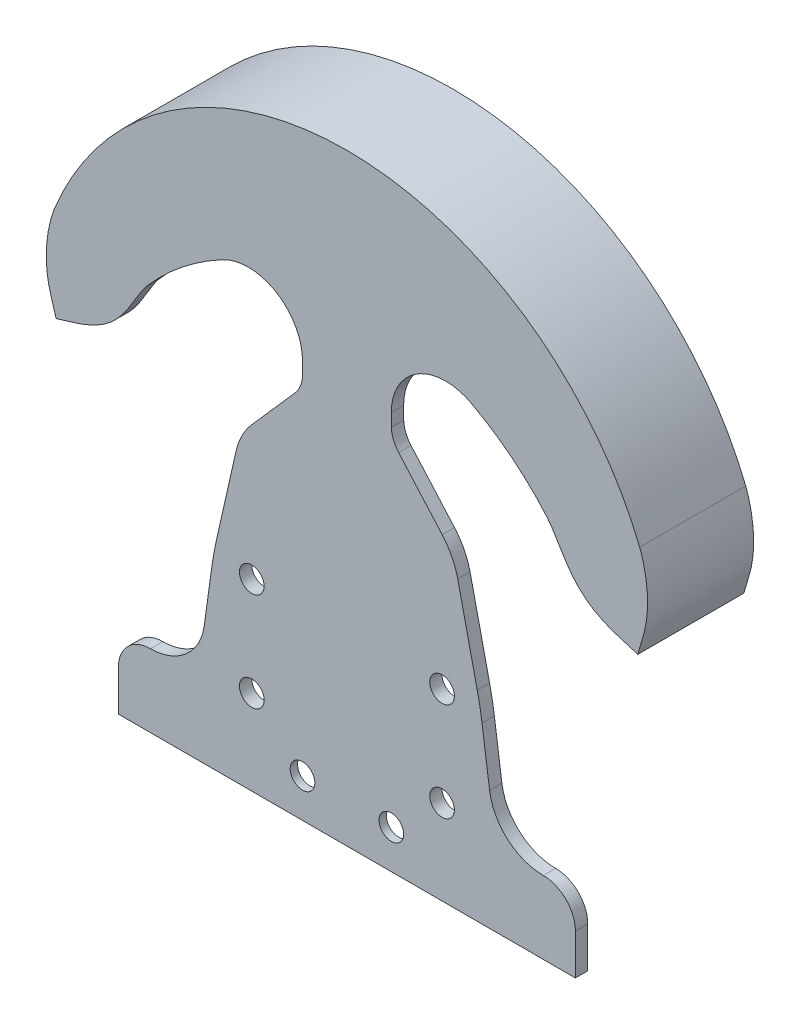
from build123d import *

# Parameters (mm, degrees)
EXTRUDE_6_DEPTH     = 5
EXTRUDE_START       = 35
EXTRUDE_7_DEPTH     = 35
EXTRUDE_START_2     = 3
EXTRUDE_9_DEPTH     = 3
EXTRUDE_START_3     = -5
EXTRUDE_10_DEPTH    = 5
SKETCH_10_W         = 60
SKETCH_10_H         = 60
CUT_EXTRUDE_1_DEPTH = 2
SKETCH_11_R         = 5
CUT_EXTRUDE_2_DEPTH = 452.099681051
SKETCH_12_R         = 5
EXTRUDE_11_DEPTH    = 8.5
SKETCH_13_R         = 5
CUT_EXTRUDE_3_DEPTH = 452.27255871


with BuildPart() as part:
    # 草图1 → 凸台-拉伸6 (new body)
    with BuildSketch(Plane.XY):
        with BuildLine():
            Line((-261.450720316, 145.890589925), (-225.450720316, 145.890589925))
            Line((-225.450720316, 145.890589925), (-225.450720316, 178.890589925))
            ThreePointArc((-225.450720316, 178.890589925), (-214.769626935, 197.755434291), (-193.097779139, 198.302354631))
            ThreePointArc((-193.097779139, 198.302354631), (-176.57396716, 187.416034475), (-162.337296497, 173.673198621))
            add(Edge.make_bspline(
                [(-162.337296497, 173.673198621), (-162.156875291, 173.463481873), (-161.822225891, 173.054756566), (-161.063474452, 172.050768196), (-160.063987759, 170.585134366), (-158.787124206, 168.543836152), (-156.997641473, 165.568209672), (-154.571279927, 161.549889138), (-151.626375874, 157.538077997), (-148.672649817, 154.494736574), (-146.127007775, 152.364528927), (-143.251428184, 150.44315688), (-140.050440584, 148.751400908), (-137.115285344, 147.525731802), (-134.879758049, 146.743974589), (-133.82475202, 146.40525156), (-133.304192156, 146.244484384), (-133.018197555, 146.156935282), (-132.49622001, 145.996719787), (-131.761747497, 145.771494768), (-130.580333604, 145.409094728), (-128.515792668, 144.775850911), (-126.745180421, 144.232742639), (-125.564995753, 143.870743314)],
                knots=[0, 0, 0, 0, 0.036189277, 0.072378554, 0.144757108, 0.217135663, 0.289514217, 0.434271325, 0.579028433, 0.651406988, 0.723785542, 0.796164096, 0.86854265, 0.940921204, 0.977110481, 0.99520512, 0.99972878, 1.004252439, 1.013299759, 1.031394397, 1.049489036, 1.085678313, 1.158056867, 1.158056867, 1.158056867, 1.158056867], degree=3))
            add(Edge.make_bspline(
                [(-125.564995753, 143.870743314), (-125.319328425, 144.703783329), (-124.950831601, 145.953319109), (-124.459485834, 147.619463786), (-124.091018178, 148.868829865), (-123.783829848, 149.910735954), (-123.538375028, 150.742539585), (-123.384292129, 151.26633611), (-123.262568578, 151.676397427), (-123.103211031, 152.229505213), (-122.860854039, 153.128803703), (-122.424172839, 154.96575744), (-121.975216766, 157.5298623), (-121.665266817, 160.53504042), (-121.554138645, 163.432908823), (-121.626990365, 167.132016891), (-122.057224922, 171.398449835), (-122.756266397, 175.071531477), (-123.379742187, 177.589111625), (-123.858705151, 179.255312853), (-124.251233744, 180.450589585), (-124.560787997, 181.304793735), (-124.711671396, 181.693138272), (-124.791544522, 181.890589925)],
                knots=[0, 0, 0, 0, 0.077542679, 0.116314019, 0.155085358, 0.193856698, 0.213242368, 0.232628037, 0.242320872, 0.252013707, 0.271399377, 0.310170717, 0.387713396, 0.465256075, 0.542798754, 0.620341433, 0.775426792, 0.93051215, 1.008054829, 1.085597508, 1.163140187, 1.201911527, 1.240682866, 1.240682866, 1.240682866, 1.240682866], degree=3))
            ThreePointArc((-124.791544522, 181.890589925), (-243.450720316, 261.890589925), (-362.109896109, 181.890589925))
            add(Edge.make_bspline(
                [(-362.109896109, 181.890589925), (-362.189769235, 181.693138272), (-362.340652634, 181.304793735), (-362.650206888, 180.450589585), (-363.04273548, 179.255312853), (-363.521698445, 177.589111625), (-364.145174234, 175.071531477), (-364.844215709, 171.398449835), (-365.274450267, 167.132016891), (-365.347301986, 163.432908823), (-365.236173814, 160.53504042), (-364.926223866, 157.5298623), (-364.477267792, 154.96575744), (-364.040586592, 153.128803703), (-363.798229601, 152.229505213), (-363.638872054, 151.676397427), (-363.517148503, 151.26633611), (-363.363065603, 150.742539585), (-363.117610784, 149.910735954), (-362.810422454, 148.868829865), (-362.441954797, 147.619463786), (-361.950609031, 145.953319109), (-361.582112206, 144.703783329), (-361.336444879, 143.870743314)],
                knots=[0, 0, 0, 0, 0.03877134, 0.077542679, 0.155085358, 0.232628037, 0.310170717, 0.465256075, 0.620341433, 0.697884112, 0.775426792, 0.852969471, 0.93051215, 0.969283489, 0.988669159, 0.998361994, 1.008054829, 1.027440499, 1.046826169, 1.085597508, 1.124368848, 1.163140187, 1.240682866, 1.240682866, 1.240682866, 1.240682866], degree=3))
            add(Edge.make_bspline(
                [(-361.336444879, 143.870743314), (-360.15626021, 144.232742639), (-358.385647964, 144.775850911), (-356.321107028, 145.409094728), (-355.139693134, 145.771494768), (-354.405220621, 145.996719787), (-353.883243076, 146.156935282), (-353.597248475, 146.244484384), (-353.076688611, 146.40525156), (-352.021682583, 146.743974589), (-349.786155288, 147.525731802), (-346.851000047, 148.751400908), (-343.650012448, 150.44315688), (-340.774432857, 152.364528927), (-338.228790814, 154.494736574), (-335.275064757, 157.538077997), (-332.330160705, 161.549889138), (-329.903799158, 165.568209672), (-328.114316425, 168.543836152), (-326.837452873, 170.585134366), (-325.83796618, 172.050768196), (-325.079214741, 173.054756566), (-324.74456534, 173.463481873), (-324.564144135, 173.673198621)],
                knots=[0, 0, 0, 0, 0.072378554, 0.108567831, 0.12666247, 0.144757108, 0.153804428, 0.158328087, 0.162851747, 0.180946385, 0.217135663, 0.289514217, 0.361892771, 0.434271325, 0.506649879, 0.579028433, 0.723785542, 0.86854265, 0.940921204, 1.013299759, 1.085678313, 1.12186759, 1.158056867, 1.158056867, 1.158056867, 1.158056867], degree=3))
            ThreePointArc((-324.564144135, 173.673198621), (-310.327473472, 187.416034475), (-293.803661492, 198.302354631))
            ThreePointArc((-293.803661492, 198.302354631), (-272.131813696, 197.755434291), (-261.450720316, 178.890589925))
            Line((-261.450720316, 178.890589925), (-261.450720316, 145.890589925))
        make_face()
    extrude(amount=EXTRUDE_6_DEPTH)

    # 草图4 → 凸台-拉伸7 (add)
    with BuildSketch(Plane(origin=(0, 0, 0), x_dir=(-1, 0, 0), z_dir=(0, 0, -1)).offset(EXTRUDE_START)):
        with BuildLine():
            Line((127.170262667, 149.033300918), (125.564995753, 143.870743314))
            add(Edge.make_bspline(
                [(124.791544522, 181.890589925), (124.711671396, 181.693138272), (124.560787997, 181.304793735), (124.251233744, 180.450589585), (123.858705151, 179.255312853), (123.379742187, 177.589111625), (122.756266397, 175.071531477), (122.057224922, 171.398449835), (121.626990365, 167.132016891), (121.554138645, 163.432908823), (121.665266817, 160.53504042), (121.975216766, 157.5298623), (122.424172839, 154.96575744), (122.860854039, 153.128803703), (123.103211031, 152.229505213), (123.262568578, 151.676397427), (123.384292129, 151.26633611), (123.538375028, 150.742539585), (123.783829848, 149.910735954), (124.091018178, 148.868829865), (124.459485834, 147.619463786), (124.950831601, 145.953319109), (125.319328425, 144.703783329), (125.564995753, 143.870743314)],
                knots=[0, 0, 0, 0, 0.03877134, 0.077542679, 0.155085358, 0.232628037, 0.310170717, 0.465256075, 0.620341433, 0.697884112, 0.775426792, 0.852969471, 0.93051215, 0.969283489, 0.988669159, 0.998361994, 1.008054829, 1.027440499, 1.046826169, 1.085597508, 1.124368848, 1.163140187, 1.240682866, 1.240682866, 1.240682866, 1.240682866], degree=3))
            ThreePointArc((124.791544522, 181.890589925), (243.450720316, 261.890589925), (362.109896109, 181.890589925))
            add(Edge.make_bspline(
                [(361.336444879, 143.870743314), (361.582112206, 144.703783329), (361.950609031, 145.953319109), (362.441954797, 147.619463786), (362.810422454, 148.868829865), (363.117610784, 149.910735954), (363.363065603, 150.742539585), (363.517148503, 151.26633611), (363.638872054, 151.676397427), (363.798229601, 152.229505213), (364.040586592, 153.128803703), (364.477267792, 154.96575744), (364.926223866, 157.5298623), (365.236173814, 160.53504042), (365.347301986, 163.432908823), (365.274450267, 167.132016891), (364.844215709, 171.398449835), (364.145174234, 175.071531477), (363.521698445, 177.589111625), (363.04273548, 179.255312853), (362.650206888, 180.450589585), (362.340652634, 181.304793735), (362.189769235, 181.693138272), (362.109896109, 181.890589925)],
                knots=[0, 0, 0, 0, 0.077542679, 0.116314019, 0.155085358, 0.193856698, 0.213242368, 0.232628037, 0.242320872, 0.252013707, 0.271399377, 0.310170717, 0.387713396, 0.465256075, 0.542798754, 0.620341433, 0.775426792, 0.93051215, 1.008054829, 1.085597508, 1.163140187, 1.201911527, 1.240682866, 1.240682866, 1.240682866, 1.240682866], degree=3))
            Line((361.336444879, 143.870743314), (359.731177964, 149.033300918))
            add(Edge.make_bspline(
                [(359.731177964, 149.033300918), (359.950339418, 149.776445736), (360.223965906, 150.702963861), (360.553310783, 151.82201926), (360.6884952, 152.278173605), (360.803836512, 152.671346005), (360.934892706, 153.132544258), (361.128886852, 153.858988834), (361.390896424, 154.952949665), (361.735647572, 156.660236204), (362.051196026, 158.772806677), (362.26806635, 161.256681255), (362.366276255, 164.469199799), (362.184670789, 168.271445245), (361.630356426, 172.374129003), (361.006813334, 175.319090727), (360.476773932, 177.3386287), (360.078361926, 178.675251932), (359.757641116, 179.631064702), (359.508695791, 180.3104049), (359.391206809, 180.611369751), (359.328821677, 180.765589925)],
                knots=[0.133854699, 0.133854699, 0.133854699, 0.133854699, 0.203031459, 0.220325649, 0.237619839, 0.246266934, 0.254914029, 0.27220822, 0.3067966, 0.34138498, 0.410561741, 0.479738501, 0.548915262, 0.687268783, 0.825622303, 0.963975824, 1.033152585, 1.102329345, 1.171506106, 1.206094486, 1.240682866, 1.240682866, 1.240682866, 1.240682866], degree=3))
            ThreePointArc((359.328821677, 180.765589925), (243.450720316, 258.890589925), (127.572618955, 180.765589925))
            add(Edge.make_bspline(
                [(127.572618955, 180.765589925), (127.510233823, 180.611369751), (127.392744841, 180.3104049), (127.143799516, 179.631064702), (126.823078706, 178.675251932), (126.4246667, 177.3386287), (125.894627297, 175.319090727), (125.271084206, 172.374129003), (124.716769843, 168.271445245), (124.535164377, 164.469199799), (124.633374281, 161.256681255), (124.850244605, 158.772806677), (125.16579306, 156.660236204), (125.510544207, 154.952949665), (125.77255378, 153.858988834), (125.966547926, 153.132544258), (126.09760412, 152.671346005), (126.212945431, 152.278173605), (126.348129848, 151.82201926), (126.677474725, 150.702963861), (126.951101213, 149.776445736), (127.170262667, 149.033300918)],
                knots=[0, 0, 0, 0, 0.03458838, 0.06917676, 0.138353521, 0.207530281, 0.276707042, 0.415060563, 0.553414084, 0.691767605, 0.760944365, 0.830121126, 0.899297886, 0.933886267, 0.968474647, 0.985768837, 0.994415932, 1.003063027, 1.020357217, 1.037651407, 1.106828168, 1.106828168, 1.106828168, 1.106828168], degree=3))
        make_face()
    extrude(amount=-EXTRUDE_7_DEPTH)

    # 草图5 → 凸台-拉伸9 (add)
    with BuildSketch(Plane(origin=(0, 0, -35), x_dir=(-1, 0, 0), z_dir=(0, 0, -1)).offset(EXTRUDE_START_2)):
        with BuildLine():
            ThreePointArc((331.982158518, 175.916591621), (243.450718914, 231.890591806), (154.919280911, 175.916589087))
            add(Edge.make_bspline(
                [(125.564995753, 143.870743314), (140.048024823, 150.380241778), (148.204578659, 161.771483118), (154.919280911, 175.916589087)],
                knots=[0, 0, 0, 0, 1, 1, 1, 1], degree=3))
            add(Edge.make_bspline(
                [(124.791544421, 181.890589675), (124.711671396, 181.693138272), (124.560787997, 181.304793735), (124.251233744, 180.450589585), (123.858705151, 179.255312853), (123.379742187, 177.589111625), (122.756266397, 175.071531477), (122.057224922, 171.398449835), (121.626990365, 167.132016891), (121.554138645, 163.432908823), (121.665266817, 160.53504042), (121.975216766, 157.5298623), (122.424172839, 154.96575744), (122.860854039, 153.128803703), (123.103211031, 152.229505213), (123.262568578, 151.676397427), (123.384292129, 151.26633611), (123.538375028, 150.742539585), (123.783829848, 149.910735954), (124.091018178, 148.868829865), (124.459485834, 147.619463786), (124.950831601, 145.953319109), (125.319328425, 144.703783329), (125.564995753, 143.870743314)],
                knots=[3.3e-08, 3.3e-08, 3.3e-08, 3.3e-08, 0.03877134, 0.077542679, 0.155085358, 0.232628037, 0.310170717, 0.465256075, 0.620341433, 0.697884112, 0.775426792, 0.852969471, 0.93051215, 0.969283489, 0.988669159, 0.998361994, 1.008054829, 1.027440499, 1.046826169, 1.085597508, 1.124368848, 1.163140187, 1.240682866, 1.240682866, 1.240682866, 1.240682866], degree=3))
            ThreePointArc((124.791544421, 181.890589675), (243.45071839, 261.890589925), (362.109894766, 181.890593245))
            add(Edge.make_bspline(
                [(361.336444879, 143.870743314), (361.582112197, 144.70378341), (361.950609007, 145.953319312), (362.441954754, 147.619464151), (362.810422396, 148.868830353), (363.117610714, 149.910736543), (363.363065524, 150.742540255), (363.517148417, 151.266336831), (363.638871963, 151.676398188), (363.798229504, 152.229506028), (364.040586483, 153.128804605), (364.477267653, 154.965758517), (364.92622367, 157.529863615), (365.236173534, 160.535042007), (365.347301608, 163.432910665), (365.274449745, 167.132019051), (364.844214992, 171.398452349), (364.14517332, 175.071534282), (363.521697383, 177.589114625), (363.042734316, 179.25531598), (362.650205645, 180.4505928), (362.340651333, 181.304797013), (362.189767907, 181.693141579), (362.109894766, 181.890593245)],
                knots=[-0.012406829, -0.012406829, -0.012406829, -0.012406829, 0.06513585, 0.10390719, 0.14267853, 0.181449869, 0.200835539, 0.220221209, 0.229914044, 0.239606879, 0.258992548, 0.297763888, 0.375306567, 0.452849246, 0.530391925, 0.607934605, 0.763019963, 0.918105321, 0.995648, 1.073190679, 1.150733359, 1.189504698, 1.228276255, 1.228276255, 1.228276255, 1.228276255], degree=3))
            add(Edge.make_bspline(
                [(361.336444879, 143.870743314), (346.853415021, 150.380241382), (338.696860769, 161.771485652), (331.982158518, 175.916591621)],
                knots=[0, 0, 0, 0, 1, 1, 1, 1], degree=3))
        make_face()
    extrude(amount=-EXTRUDE_9_DEPTH)

    # 草图7 → 凸台-拉伸10 (add)
    with BuildSketch(Plane.XY.offset(5).offset(EXTRUDE_START_3)):
        with BuildLine():
            Line((-225.450720316, 173.626640826), (-225.450720316, 178.890589925))
            ThreePointArc((-225.450720316, 178.890589925), (-214.769626935, 197.755434291), (-193.097779139, 198.302354631))
            ThreePointArc((-193.097779139, 198.302354631), (-176.57396716, 187.416034475), (-162.337296497, 173.673198621))
            add(Edge.make_bspline(
                [(-162.337296497, 173.673198621), (-162.156875291, 173.463481873), (-161.822225891, 173.054756566), (-161.063474452, 172.050768196), (-160.063987759, 170.585134366), (-158.787124206, 168.543836152), (-156.997641473, 165.568209672), (-154.571279927, 161.549889138), (-151.626375874, 157.538077997), (-148.672649817, 154.494736574), (-146.127007775, 152.364528927), (-143.251428184, 150.44315688), (-140.050440584, 148.751400908), (-137.115285344, 147.525731802), (-134.879758049, 146.743974589), (-133.82475202, 146.40525156), (-133.304192156, 146.244484384), (-133.018197555, 146.156935282), (-132.49622001, 145.996719787), (-131.761747497, 145.771494768), (-130.580333604, 145.409094728), (-128.515792668, 144.775850911), (-126.745180421, 144.232742639), (-125.564995753, 143.870743314)],
                knots=[0, 0, 0, 0, 0.036189277, 0.072378554, 0.144757108, 0.217135663, 0.289514217, 0.434271325, 0.579028433, 0.651406988, 0.723785542, 0.796164096, 0.86854265, 0.940921204, 0.977110481, 0.99520512, 0.99972878, 1.004252439, 1.013299759, 1.031394397, 1.049489036, 1.085678313, 1.158056867, 1.158056867, 1.158056867, 1.158056867], degree=3))
            add(Edge.make_bspline(
                [(-125.564995753, 143.870743314), (-125.319328425, 144.703783329), (-124.950831601, 145.953319109), (-124.459485834, 147.619463786), (-124.091018178, 148.868829865), (-123.783829848, 149.910735954), (-123.538375028, 150.742539585), (-123.384292129, 151.26633611), (-123.262568578, 151.676397427), (-123.103211031, 152.229505213), (-122.860854039, 153.128803703), (-122.424172839, 154.96575744), (-121.975216766, 157.5298623), (-121.665266817, 160.53504042), (-121.554138645, 163.432908823), (-121.626990365, 167.132016891), (-122.057224922, 171.398449835), (-122.756266397, 175.071531477), (-123.379742187, 177.589111625), (-123.858705151, 179.255312853), (-124.251233744, 180.450589585), (-124.560787997, 181.304793735), (-124.711671396, 181.693138272), (-124.791544522, 181.890589925)],
                knots=[0, 0, 0, 0, 0.077542679, 0.116314019, 0.155085358, 0.193856698, 0.213242368, 0.232628037, 0.242320872, 0.252013707, 0.271399377, 0.310170717, 0.387713396, 0.465256075, 0.542798754, 0.620341433, 0.775426792, 0.93051215, 1.008054829, 1.085597508, 1.163140187, 1.201911527, 1.240682866, 1.240682866, 1.240682866, 1.240682866], degree=3))
            ThreePointArc((-124.791544522, 181.890589925), (-243.450720316, 261.890589925), (-362.109896109, 181.890589925))
            add(Edge.make_bspline(
                [(-362.109896109, 181.890589925), (-362.189769235, 181.693138272), (-362.340652634, 181.304793735), (-362.650206888, 180.450589585), (-363.04273548, 179.255312853), (-363.521698445, 177.589111625), (-364.145174234, 175.071531477), (-364.844215709, 171.398449835), (-365.274450267, 167.132016891), (-365.347301986, 163.432908823), (-365.236173814, 160.53504042), (-364.926223866, 157.5298623), (-364.477267792, 154.96575744), (-364.040586592, 153.128803703), (-363.798229601, 152.229505213), (-363.638872054, 151.676397427), (-363.517148503, 151.26633611), (-363.363065603, 150.742539585), (-363.117610784, 149.910735954), (-362.810422454, 148.868829865), (-362.441954797, 147.619463786), (-361.950609031, 145.953319109), (-361.582112206, 144.703783329), (-361.336444879, 143.870743314)],
                knots=[0, 0, 0, 0, 0.03877134, 0.077542679, 0.155085358, 0.232628037, 0.310170717, 0.465256075, 0.620341433, 0.697884112, 0.775426792, 0.852969471, 0.93051215, 0.969283489, 0.988669159, 0.998361994, 1.008054829, 1.027440499, 1.046826169, 1.085597508, 1.124368848, 1.163140187, 1.240682866, 1.240682866, 1.240682866, 1.240682866], degree=3))
            add(Edge.make_bspline(
                [(-361.336444879, 143.870743314), (-360.15626021, 144.232742639), (-358.385647964, 144.775850911), (-356.321107028, 145.409094728), (-355.139693134, 145.771494768), (-354.405220621, 145.996719787), (-353.883243076, 146.156935282), (-353.597248475, 146.244484384), (-353.076688611, 146.40525156), (-352.021682583, 146.743974589), (-349.786155288, 147.525731802), (-346.851000047, 148.751400908), (-343.650012448, 150.44315688), (-340.774432857, 152.364528927), (-338.228790814, 154.494736574), (-335.275064757, 157.538077997), (-332.330160705, 161.549889138), (-329.903799158, 165.568209672), (-328.114316425, 168.543836152), (-326.837452873, 170.585134366), (-325.83796618, 172.050768196), (-325.079214741, 173.054756566), (-324.74456534, 173.463481873), (-324.564144135, 173.673198621)],
                knots=[0, 0, 0, 0, 0.072378554, 0.108567831, 0.12666247, 0.144757108, 0.153804428, 0.158328087, 0.162851747, 0.180946385, 0.217135663, 0.289514217, 0.361892771, 0.434271325, 0.506649879, 0.579028433, 0.723785542, 0.86854265, 0.940921204, 1.013299759, 1.085678313, 1.12186759, 1.158056867, 1.158056867, 1.158056867, 1.158056867], degree=3))
            ThreePointArc((-324.564144135, 173.673198621), (-310.327473472, 187.416034475), (-293.803661492, 198.302354631))
            ThreePointArc((-293.803661492, 198.302354631), (-272.131813696, 197.755434291), (-261.450720316, 178.890589925))
            Line((-261.450720316, 178.890589925), (-261.450720316, 174.184061281))
            ThreePointArc((-261.450720316, 174.184061281), (-262.225078495, 169.943192771), (-264.448214602, 166.249649465))
            Line((-264.448214602, 166.249649465), (-282.071691746, 146.253781166))
            ThreePointArc((-282.071691746, 146.253781166), (-286.002679794, 140.474134686), (-288.379664721, 133.900937359))
            Line((-288.379664721, 133.900937359), (-296.294508849, 98.810495414))
            ThreePointArc((-296.294508849, 98.810495414), (-297.36740868, 93.540250584), (-298.217963432, 88.229586668))
            Line((-298.217963432, 88.229586668), (-301.285996084, 66.106358017))
            ThreePointArc((-301.285996084, 66.106358017), (-308.628996426, 52.537953884), (-323.07744813, 47.12838014))
            ThreePointArc((-323.07744813, 47.12838014), (-332.269836286, 43.320768296), (-336.07744813, 34.12838014))
            Line((-336.07744813, 34.12838014), (-336.07744813, 17.647902504))
            Line((-336.07744813, 17.647902504), (-150.836946058, 17.647902504))
            Line((-150.836946058, 17.647902504), (-150.836946058, 34.12838014))
            ThreePointArc((-150.836946058, 34.12838014), (-154.644557902, 43.320768296), (-163.836946058, 47.12838014))
            ThreePointArc((-163.836946058, 47.12838014), (-178.285397762, 52.537953884), (-185.628398104, 66.106358017))
            Line((-185.628398104, 66.106358017), (-188.696430757, 88.229586668))
            ThreePointArc((-188.696430757, 88.229586668), (-189.546985508, 93.540250584), (-190.619885339, 98.810495414))
            Line((-190.619885339, 98.810495414), (-198.534729467, 133.900937359))
            ThreePointArc((-198.534729467, 133.900937359), (-200.911714394, 140.474134686), (-204.842702442, 146.253781166))
            Line((-204.842702442, 146.253781166), (-222.466179587, 166.249649465))
            ThreePointArc((-222.466179587, 166.249649465), (-224.58776149, 169.683541903), (-225.450720316, 173.626640826))
        make_face()
    extrude(amount=EXTRUDE_10_DEPTH)

    # 草图10 → 切除-拉伸1 (cut)
    with BuildSketch(Plane(origin=(0, 0, 0), x_dir=(-1, 0, 0), z_dir=(0, 0, -1))):
        with Locations((243.457197094, 47.647902504)):
            Rectangle(SKETCH_10_W, SKETCH_10_H)
    extrude(amount=-CUT_EXTRUDE_1_DEPTH, mode=Mode.SUBTRACT)

    # 草图11 → 切除-拉伸2 (cut, through all)
    with BuildSketch(Plane(origin=(0, 0, 0), x_dir=(-1, 0, 0), z_dir=(0, 0, -1))):
        with Locations((204.892206489, 92.050076477)):
            Circle(SKETCH_11_R)
        with Locations((204.892206489, 52.050076477)):
            Circle(SKETCH_11_R)
        with Locations(Location((282.022187699, 52.050076477, 0), (0, 0, 180))):
            Circle(SKETCH_11_R)
        with Locations(Location((282.022187699, 92.050076477, 0), (0, 0, 180))):
            Circle(SKETCH_11_R)
    extrude(amount=-CUT_EXTRUDE_2_DEPTH, mode=Mode.SUBTRACT)

    # 草图12 → 凸台-拉伸11 (add)
    with BuildSketch(Plane(origin=(0, 0, 2), x_dir=(-1, 0, 0), z_dir=(0, 0, -1))):
        with Locations((225.457197094, 65.647902504)):
            Circle(SKETCH_12_R)
        with Locations(Location((261.457197094, 65.647902504, 0), (0, 0, 180))):
            Circle(SKETCH_12_R)
    extrude(amount=EXTRUDE_11_DEPTH)

    # 草图13 → 切除-拉伸3 (cut, through all)
    with BuildSketch(Plane(origin=(0, 0, 2), x_dir=(-1, 0, 0), z_dir=(0, 0, -1))):
        with Locations((225.457197094, 33.28297392)):
            Circle(SKETCH_13_R)
        with Locations(Location((261.457197094, 33.28297392, 0), (0, 0, 180))):
            Circle(SKETCH_13_R)
    extrude(amount=-CUT_EXTRUDE_3_DEPTH, mode=Mode.SUBTRACT)


solid = part.part
